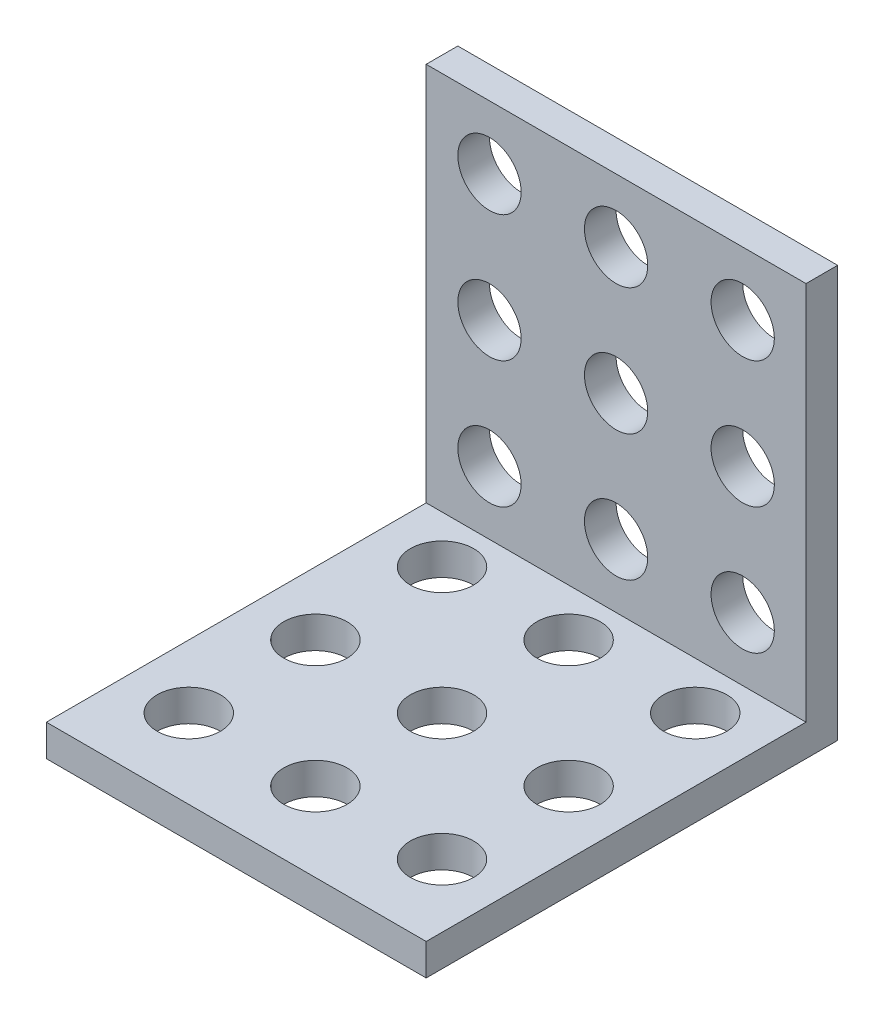
from build123d import *

# Parameters (mm, degrees)
SKETCH1_W           = 24
SKETCH1_H           = 24
SKETCH1_R           = 2
BOSS_EXTRUDE1_DEPTH = 2
SKETCH1_3_W         = 24
SKETCH1_3_H         = 2
BOSS_EXTRUDE2_DEPTH = 26
SKETCH2_R           = 2
CUT_EXTRUDE1_DEPTH  = 26


with BuildPart() as part:
    # Sketch1 → Boss-Extrude1 (new body)
    with BuildSketch(Plane(origin=(0, 0, 0), x_dir=(1, 0, 0), z_dir=(0, 1, 0))):
        with Locations((0, -1)):
            Rectangle(SKETCH1_W, SKETCH1_H)
        with Locations((-8, -8)):
            Circle(SKETCH1_R, mode=Mode.SUBTRACT)
        with Locations((-8, 0)):
            Circle(SKETCH1_R, mode=Mode.SUBTRACT)
        with Locations((0, -8)):
            Circle(SKETCH1_R, mode=Mode.SUBTRACT)
        with Locations((8, -8)):
            Circle(SKETCH1_R, mode=Mode.SUBTRACT)
        Circle(SKETCH1_R, mode=Mode.SUBTRACT)
        with Locations((8, 0)):
            Circle(SKETCH1_R, mode=Mode.SUBTRACT)
        with Locations((-8, 8)):
            Circle(SKETCH1_R, mode=Mode.SUBTRACT)
        with Locations((0, 8)):
            Circle(SKETCH1_R, mode=Mode.SUBTRACT)
        with Locations((8, 8)):
            Circle(SKETCH1_R, mode=Mode.SUBTRACT)
    extrude(amount=BOSS_EXTRUDE1_DEPTH)

    # Sketch1<3> → Boss-Extrude2 (add)
    with BuildSketch(Plane(origin=(0, 0, 0), x_dir=(1, 0, 0), z_dir=(0, 1, 0))):
        with Locations((0, 12)):
            Rectangle(SKETCH1_3_W, SKETCH1_3_H)
    extrude(amount=BOSS_EXTRUDE2_DEPTH)

    # Sketch2 → Cut-Extrude1 (cut)
    with BuildSketch(Plane.XY.offset(-11)):
        with Locations((-8, 22)):
            Circle(SKETCH2_R)
        with Locations((0, 22)):
            Circle(SKETCH2_R)
        with Locations((8, 22)):
            Circle(SKETCH2_R)
        with Locations((-8, 14)):
            Circle(SKETCH2_R)
        with Locations((0, 14)):
            Circle(SKETCH2_R)
        with Locations((8, 14)):
            Circle(SKETCH2_R)
        with Locations((8, 6)):
            Circle(SKETCH2_R)
        with Locations((0, 6)):
            Circle(SKETCH2_R)
        with Locations((-8, 6)):
            Circle(SKETCH2_R)
    extrude(amount=-CUT_EXTRUDE1_DEPTH, mode=Mode.SUBTRACT)


solid = part.part
